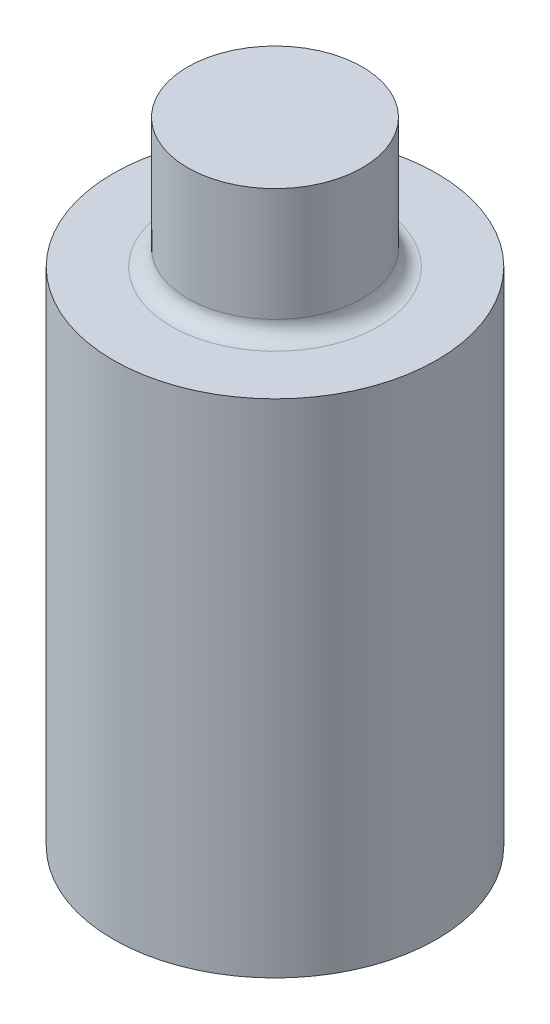
from build123d import *

# Parameters (mm, degrees)
SKETCH1_R           = 5
SKETCH1_R_2         = 2.7
BOSS_EXTRUDE1_DEPTH = 15.5
BOSS_EXTRUDE2_START = 15.5
SKETCH1_4_R         = 2.7
BOSS_EXTRUDE2_DEPTH = 4
FILLET1_R           = 0.5


with BuildPart() as part:
    # Sketch1 → Boss-Extrude1 (new body)
    # profile 1 of 2: a face of its own
    with BuildSketch(Plane(origin=(0, 0, 0), x_dir=(1, 0, 0), z_dir=(0, 1, 0))):
        with Locations(Location((0, 0, 0), (0, 0, 270))):
            Circle(SKETCH1_R)
        Circle(SKETCH1_R_2, mode=Mode.SUBTRACT)
    # profile 2 of 2: a face of its own
    with BuildSketch(Plane(origin=(0, 0, 0), x_dir=(1, 0, 0), z_dir=(0, 1, 0))):
        Circle(SKETCH1_R_2)
    extrude(amount=BOSS_EXTRUDE1_DEPTH)

    # Sketch1<4> → Boss-Extrude2 (add)
    with BuildSketch(Plane(origin=(0, 0, 0), x_dir=(1, 0, 0), z_dir=(0, 1, 0)).offset(BOSS_EXTRUDE2_START)):
        with Locations(Location((0, 0, 0), (0, 0, 270))):
            Circle(SKETCH1_4_R)
    extrude(amount=BOSS_EXTRUDE2_DEPTH)

    # Fillet1
    fillet1_edges = [part.edges().sort_by_distance(p)[0] for p in [
        (0, 15.5, -2.7),
    ]]
    fillet(fillet1_edges, radius=FILLET1_R)


solid = part.part
